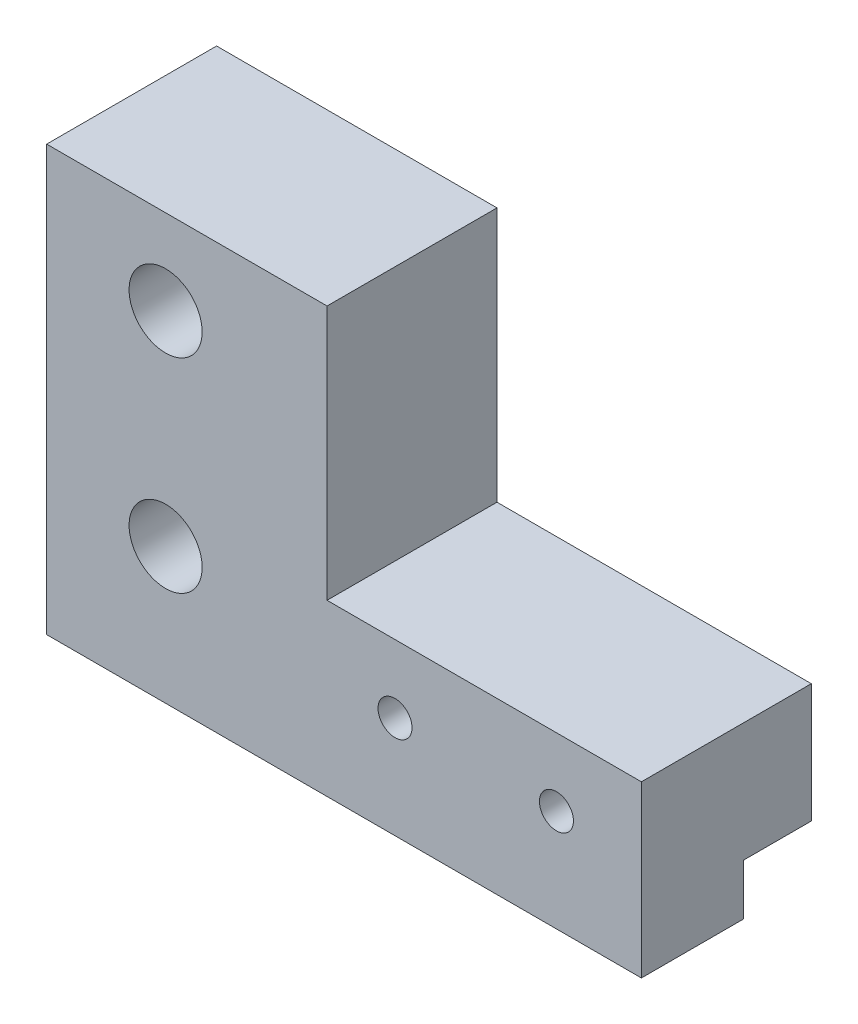
from build123d import *

# Parameters (mm, degrees)
SKETCH1_R           = 2.15
BOSS_EXTRUDE1_DEPTH = 10
SKETCH3_W           = 75
SKETCH3_H           = 3
CUT_EXTRUDE1_DEPTH  = 4
SKETCH4_W           = 40
SKETCH4_H           = 25
CUT_EXTRUDE2_DEPTH  = 44.660622991
SKETCH5_R           = 1
CUT_EXTRUDE3_DEPTH  = 44.660622991


with BuildPart() as part:
    # Sketch1 → Boss-Extrude1 (new body)
    with BuildSketch(Plane.XY):
        Polygon((21, 5), (37.5, 5), (37.5, -20), (-37.5, -20), (-37.5, 5), (-21, 5), (-21, -10), (21, -10), align=None)
        with Locations((-30.5, 0)):
            Circle(SKETCH1_R, mode=Mode.SUBTRACT)
        with Locations((-30.5, -12)):
            Circle(SKETCH1_R, mode=Mode.SUBTRACT)
        with Locations((30.5, 0)):
            Circle(SKETCH1_R, mode=Mode.SUBTRACT)
        with Locations((30.5, -12)):
            Circle(SKETCH1_R, mode=Mode.SUBTRACT)
    extrude(amount=BOSS_EXTRUDE1_DEPTH)

    # Sketch3 → Cut-Extrude1 (cut)
    with BuildSketch(Plane(origin=(0, 0, 0), x_dir=(-1, 0, 0), z_dir=(0, 0, -1))):
        with Locations((0, -18.5)):
            Rectangle(SKETCH3_W, SKETCH3_H)
    extrude(amount=-CUT_EXTRUDE1_DEPTH, mode=Mode.SUBTRACT)

    # Sketch4 → Cut-Extrude2 (cut, through all)
    with BuildSketch(Plane.XY.offset(10)):
        with Locations((17.5, -7.5)):
            Rectangle(SKETCH4_W, SKETCH4_H)
    extrude(amount=-CUT_EXTRUDE2_DEPTH, mode=Mode.SUBTRACT)

    # Sketch5 → Cut-Extrude3 (cut, through all)
    with BuildSketch(Plane.XY.offset(10)):
        with Locations((-7.5, -14)):
            Circle(SKETCH5_R)
        with Locations((-17, -14)):
            Circle(SKETCH5_R)
    extrude(amount=-CUT_EXTRUDE3_DEPTH, mode=Mode.SUBTRACT)


solid = part.part
